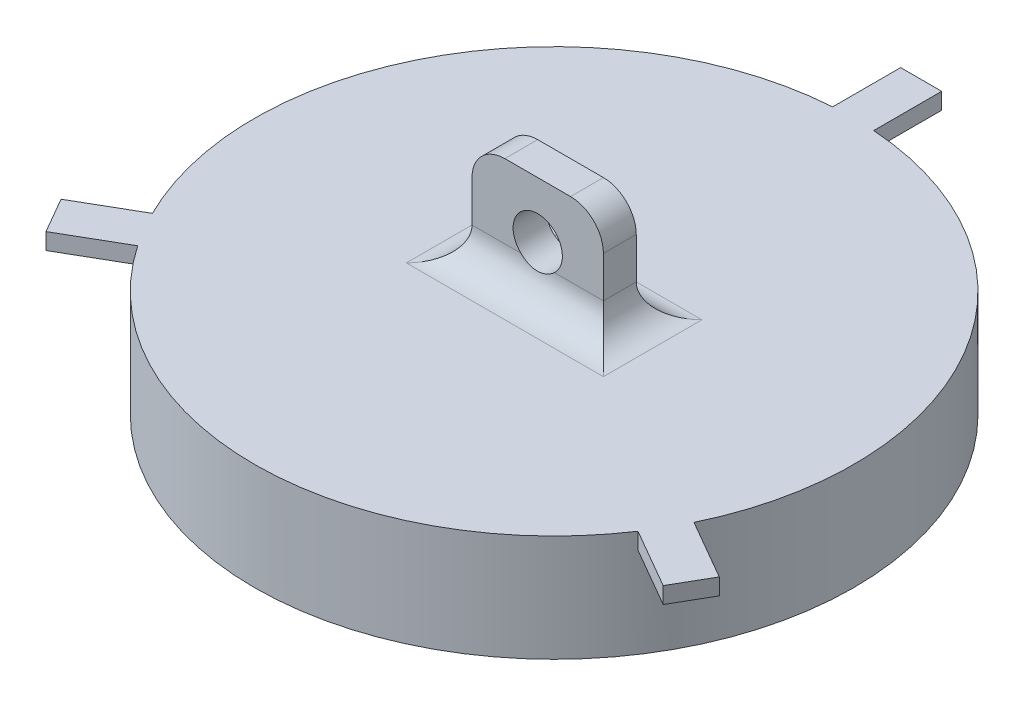
from build123d import *

# Parameters (mm, degrees)
SKETCH1_R               = 18.25
SKETCH1_R_2             = 17.75
BOSS_EXTRUDE1_DEPTH     = 6.5
BOSS_EXTRUDE2_START     = -1.5
SKETCH2_R               = 18.25
BOSS_EXTRUDE2_DEPTH     = 1.5
BOSS_EXTRUDE3_START     = -0.5
SKETCH3_W               = 2.5
SKETCH3_H               = 6.738143646
BOSS_EXTRUDE3_DEPTH     = 1
SKETCH4_W               = 8
SKETCH4_H               = 2
BOSS_EXTRUDE4_DEPTH     = 8
FILLET1_R               = 2
CUT_EXTRUDE1_DEPTH      = 34.430553991
CUT_EXTRUDE1_DEPTH_BACK = 34.430553991
SKETCH5_R               = 1.5
FILLET2_R               = 2


with BuildPart() as part:
    # Sketch1 → Boss-Extrude1 (new body)
    with BuildSketch(Plane(origin=(0, 0, 0), x_dir=(1, 0, 0), z_dir=(0, 1, 0))):
        with Locations(Location((0, 0, 0), (0, 0, 90))):
            Circle(SKETCH1_R)
        with Locations(Location((0, 0, 0), (0, 0, 90))):
            Circle(SKETCH1_R_2, mode=Mode.SUBTRACT)
    extrude(amount=BOSS_EXTRUDE1_DEPTH)

    # Sketch2 → Boss-Extrude2 (add)
    with BuildSketch(Plane(origin=(0, 6.5, 0), x_dir=(1, 0, 0), z_dir=(0, 1, 0)).offset(BOSS_EXTRUDE2_START)):
        with Locations(Location((0, 0, 0), (0, 0, 90))):
            Circle(SKETCH2_R)
    extrude(amount=BOSS_EXTRUDE2_DEPTH)

    # Sketch3 → Boss-Extrude3 (add)
    with BuildSketch(Plane(origin=(0, 5, 0), x_dir=(-1, 0, 0), z_dir=(0, -1, 0)).offset(BOSS_EXTRUDE3_START)):
        Polygon((18.622786456, -12.318351976), (12.787382884, -8.949280153), (14.037382884, -6.784216644), (19.872786456, -10.153288467), align=None)
        with Locations((0, 18.97946309)):
            Rectangle(SKETCH3_W, SKETCH3_H)
        Polygon((-20.086011489, -10.030182937), (-14.250607917, -6.661111114), (-13.000607917, -8.826174624), (-18.836011489, -12.195246447), align=None)
    extrude(amount=-BOSS_EXTRUDE3_DEPTH)

    # Sketch4 → Boss-Extrude4 (add)
    with BuildSketch(Plane(origin=(0, 5, 0), x_dir=(-1, 0, 0), z_dir=(0, -1, 0))):
        Rectangle(SKETCH4_W, SKETCH4_H)
    extrude(amount=-BOSS_EXTRUDE4_DEPTH)

    # Fillet1
    fillet1_edges = [part.edges().sort_by_distance(p)[0] for p in [
        (-4, 6.5, 0),
        (0, 6.5, 1),
        (4, 6.5, 0),
        (0, 6.5, -1),
    ]]
    fillet(fillet1_edges, radius=FILLET1_R)

    # Sketch5 → Cut-Extrude1 (cut, two sides: drawn at the far end of the back side and taken through both)
    with BuildSketch(Plane.XY.offset(1).offset(-CUT_EXTRUDE1_DEPTH_BACK)):
        with Locations(Location((0, 9.597763348, 0), (0, 0, 312.958942011))):
            Circle(SKETCH5_R)
    extrude(amount=CUT_EXTRUDE1_DEPTH + CUT_EXTRUDE1_DEPTH_BACK, mode=Mode.SUBTRACT)

    # Fillet2
    fillet2_edges = [part.edges().sort_by_distance(p)[0] for p in [
        (-4, 13, 0),
        (4, 13, 0),
    ]]
    fillet(fillet2_edges, radius=FILLET2_R)


solid = part.part
